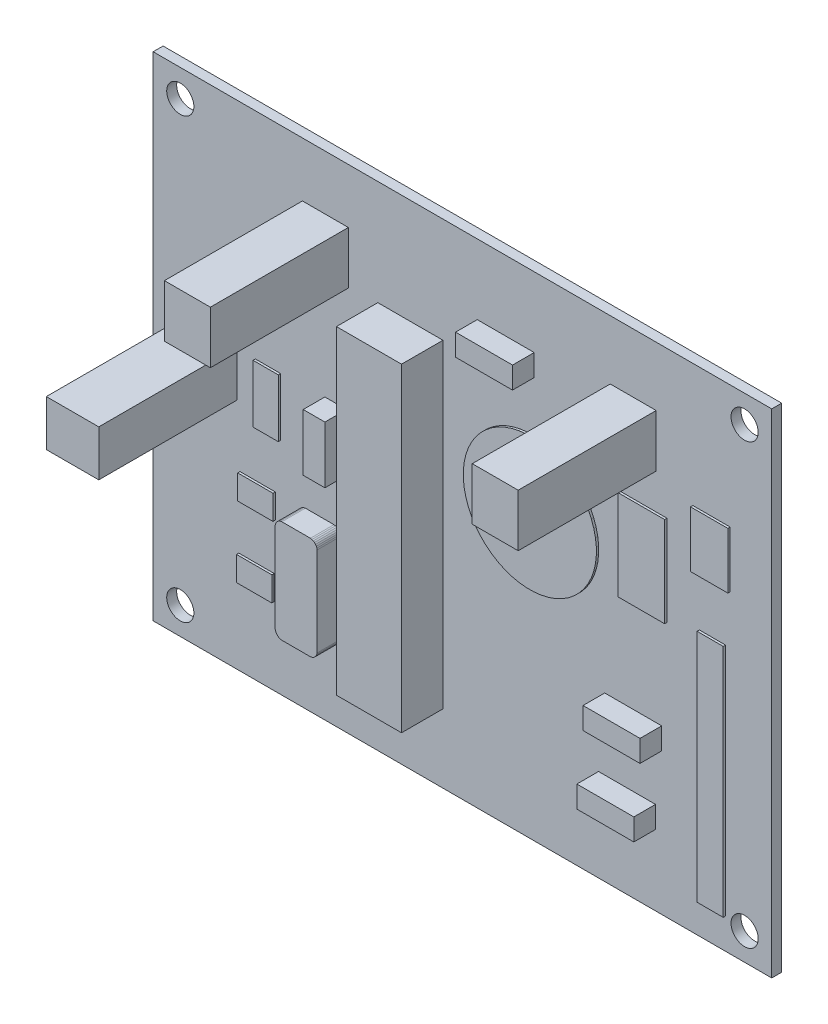
from build123d import *

# Parameters (mm, degrees)
SKETCH1_W                     = 68.4
SKETCH1_H                     = 54.5
BOARD_DEPTH                   = 1.1
SKETCH2_W                     = 2.89
SKETCH2_H                     = 25.95
FP_61301011121_MFG_1_DEPTH    = 0.254
SKETCH3_W                     = 5.16
SKETCH3_H                     = 9.98
FP_3296W_MFG_1_DEPTH          = 0.254
SKETCH4_W                     = 6.3
SKETCH4_H                     = 2.4
RESA60_630X240_1_DEPTH        = 2.3984
SKETCH5_W                     = 6.3
SKETCH5_H                     = 2.4
RESA60_630X240_2_DEPTH        = 2.3984
SKETCH6_W                     = 2.4
SKETCH6_H                     = 6.3
RESA60_630X240_3_DEPTH        = 2.3984
SKETCH7_W                     = 6.3
SKETCH7_H                     = 2.4
RESA60_630X240_4_DEPTH        = 2.3984
SKETCH8_W                     = 5.08
SKETCH8_H                     = 5.7999
MOLX_22_27_2021_V_1_DEPTH     = 15.26
SKETCH9_W                     = 5.08
SKETCH9_H                     = 5.7999
MOLX_22_27_2021_V_2_DEPTH     = 15.26
SKETCH10_W                    = 5.7999
SKETCH10_H                    = 5.08
MOLX_22_27_2021_V_3_DEPTH     = 15.26
SKETCH14_W                    = 4.14
SKETCH14_H                    = 6.2
FP_TMM_103_03_T_S_MFG_1_DEPTH = 0.254
FOX_FOXSLF160_20_1_DEPTH      = 2.6
SKETCH16_W                    = 7.2
SKETCH16_H                    = 35.3
EXTRUDE_28P3_1_DEPTH          = 4.58
SKETCH17_W                    = 2.8
SKETCH17_H                    = 6.4
FP_K15H5_MFG_1_DEPTH          = 0.254
SKETCH18_W                    = 3.9
SKETCH18_H                    = 2.7
FP_RCE0DB_MFG_1_DEPTH         = 0.254
SKETCH19_W                    = 3.9
SKETCH19_H                    = 2.7
FP_RCE0DB_MFG_2_DEPTH         = 0.254
FP_PS1440P02BT_MFG_1_DEPTH    = 0.254
SKETCH21_R                    = 1.5
CUT_EXTRUDE1_DEPTH            = 1.1


with BuildPart() as part:
    # Sketch1 → BOARD (new body)
    with BuildSketch(Plane.XY):
        with Locations((34.2, 27.35)):
            Rectangle(SKETCH1_W, SKETCH1_H)
    extrude(amount=BOARD_DEPTH)

    # Sketch21 → Cut-Extrude1 (cut)
    with BuildSketch(Plane.XY.offset(1.1)):
        with Locations((65.4, 51.6)):
            Circle(SKETCH21_R)
        with Locations((3, 51.6)):
            Circle(SKETCH21_R)
        with Locations((3, 3.1)):
            Circle(SKETCH21_R)
        with Locations((65.4, 3.1)):
            Circle(SKETCH21_R)
    extrude(amount=-CUT_EXTRUDE1_DEPTH, mode=Mode.SUBTRACT)


with BuildPart() as body_2:
    # Sketch2 → FP-61301011121-MFG-1 (new body)
    with BuildSketch(Plane.XY.offset(1.1)):
        with Locations((61.845, 16.454)):
            Rectangle(SKETCH2_W, SKETCH2_H)
    extrude(amount=FP_61301011121_MFG_1_DEPTH)


with BuildPart() as body_3:
    # Sketch3 → FP-3296W-MFG-1 (new body)
    with BuildSketch(Plane.XY.offset(1.1)):
        with Locations((54.225, 33.345)):
            Rectangle(SKETCH3_W, SKETCH3_H)
    extrude(amount=FP_3296W_MFG_1_DEPTH)


with BuildPart() as body_4:
    # Sketch4 → RESA60-630X240-1 (new body)
    with BuildSketch(Plane.XY.offset(1.1)):
        with Locations((52.4, 9.1)):
            Rectangle(SKETCH4_W, SKETCH4_H)
    extrude(amount=RESA60_630X240_1_DEPTH)


with BuildPart() as body_5:
    # Sketch5 → RESA60-630X240-2 (new body)
    with BuildSketch(Plane.XY.offset(1.1)):
        with Locations((53.082, 16.962)):
            Rectangle(SKETCH5_W, SKETCH5_H)
    extrude(amount=RESA60_630X240_2_DEPTH)


with BuildPart() as body_6:
    # Sketch6 → RESA60-630X240-3 (new body)
    with BuildSketch(Plane.XY.offset(1.1)):
        with Locations((20.189, 27.884)):
            Rectangle(SKETCH6_W, SKETCH6_H)
    extrude(amount=RESA60_630X240_3_DEPTH)


with BuildPart() as body_7:
    # Sketch7 → RESA60-630X240-4 (new body)
    with BuildSketch(Plane.XY.offset(1.1)):
        with Locations((38.985, 45.664)):
            Rectangle(SKETCH7_W, SKETCH7_H)
    extrude(amount=RESA60_630X240_4_DEPTH)


with BuildPart() as body_8:
    # Sketch8 → MOLX-22-27-2021_V-1 (new body)
    with BuildSketch(Plane.XY.offset(1.1)):
        with Locations((53.0822, 45.15615)):
            Rectangle(SKETCH8_W, SKETCH8_H)
    extrude(amount=MOLX_22_27_2021_V_1_DEPTH)


with BuildPart() as body_9:
    # Sketch9 → MOLX-22-27-2021_V-2 (new body)
    with BuildSketch(Plane.XY.offset(1.1)):
        with Locations((19.0458, 45.66385)):
            Rectangle(SKETCH9_W, SKETCH9_H)
    extrude(amount=MOLX_22_27_2021_V_2_DEPTH)


with BuildPart() as body_10:
    # Sketch10 → MOLX-22-27-2021_V-3 (new body)
    with BuildSketch(Plane.XY.offset(1.1)):
        with Locations((6.34585, 28.3922)):
            Rectangle(SKETCH10_W, SKETCH10_H)
    extrude(amount=MOLX_22_27_2021_V_3_DEPTH)


with BuildPart() as body_11:
    # Sketch14 → FP-TMM-103-03-T-S-MFG-1 (new body)
    with BuildSketch(Plane.XY.offset(1.1)):
        with Locations((61.738, 37.885)):
            Rectangle(SKETCH14_W, SKETCH14_H)
    extrude(amount=FP_TMM_103_03_T_S_MFG_1_DEPTH)


with BuildPart() as body_12:
    # Sketch15 → FOX-FOXSLF160-20-1 (new body)
    with BuildSketch(Plane.XY.offset(1.1)):
        Polygon((20.1515, 19.2764), (20.3017, 19.2142), (20.4368, 19.1239), (20.5517, 19.009), (20.642, 18.8739), (20.7042, 18.7237), (20.7359, 18.5643), (20.7359, 18.4831), (20.7359, 8.7831), (20.7359, 8.7018), (20.7042, 8.5425), (20.642, 8.3923), (20.5517, 8.2572), (20.4368, 8.1423), (20.3017, 8.052), (20.1516, 7.9898), (19.9922, 7.9581), (19.9109, 7.9581), (16.9109, 7.9581), (16.8296, 7.9581), (16.6703, 7.9898), (16.5201, 8.052), (16.385, 8.1423), (16.2701, 8.2572), (16.1798, 8.3923), (16.1176, 8.5424), (16.0859, 8.7018), (16.0859, 8.783), (16.0859, 18.4831), (16.0859, 18.5643), (16.1176, 18.7237), (16.1798, 18.8739), (16.2701, 19.009), (16.385, 19.1239), (16.5201, 19.2142), (16.6703, 19.2764), (16.8296, 19.3081), (16.9109, 19.3081), (19.9109, 19.3081), (19.9921, 19.3081), align=None)
    extrude(amount=FOX_FOXSLF160_20_1_DEPTH)


with BuildPart() as body_13:
    # Sketch16 → Extrude 28P3-1 (new body)
    with BuildSketch(Plane.XY.offset(1.1)):
        with Locations((28.444, 25.344)):
            Rectangle(SKETCH16_W, SKETCH16_H)
    extrude(amount=EXTRUDE_28P3_1_DEPTH)


with BuildPart() as body_14:
    # Sketch17 → FP-K15H5-MFG-1 (new body)
    with BuildSketch(Plane.XY.offset(1.1)):
        with Locations((12.696, 27.63)):
            Rectangle(SKETCH17_W, SKETCH17_H)
    extrude(amount=FP_K15H5_MFG_1_DEPTH)


with BuildPart() as body_15:
    # Sketch18 → FP-RCE0DB-MFG-1 (new body)
    with BuildSketch(Plane.XY.offset(1.1)):
        with Locations((11.426, 9.977)):
            Rectangle(SKETCH18_W, SKETCH18_H)
    extrude(amount=FP_RCE0DB_MFG_1_DEPTH)


with BuildPart() as body_16:
    # Sketch19 → FP-RCE0DB-MFG-2 (new body)
    with BuildSketch(Plane.XY.offset(1.1)):
        with Locations((11.553, 17.851)):
            Rectangle(SKETCH19_W, SKETCH19_H)
    extrude(amount=FP_RCE0DB_MFG_2_DEPTH)


with BuildPart() as body_17:
    # Sketch20 → FP-PS1440P02BT-MFG-1 (new body)
    with BuildSketch(Plane.XY.offset(1.1)):
        Polygon((43.1391, 38.7846), (43.9439, 38.6009), (44.7232, 38.3282), (45.4669, 37.97), (46.1659, 37.5308), (46.8113, 37.0161), (47.3951, 36.4324), (47.9098, 35.7869), (48.349, 35.0879), (48.7072, 34.3442), (48.9799, 33.5649), (49.1636, 32.7601), (49.256, 31.9398), (49.256, 31.1142), (49.1636, 30.2939), (48.9799, 29.4891), (48.7072, 28.7099), (48.349, 27.9661), (47.9098, 27.2671), (47.3951, 26.6217), (46.8113, 26.0379), (46.1659, 25.5232), (45.4669, 25.084), (44.7232, 24.7258), (43.9439, 24.4531), (43.1391, 24.2694), (42.3188, 24.177), (41.4932, 24.177), (40.6729, 24.2694), (39.8681, 24.4531), (39.0888, 24.7258), (38.3451, 25.084), (37.6461, 25.5232), (37.0006, 26.0379), (36.4169, 26.6217), (35.9022, 27.2671), (35.463, 27.9661), (35.1048, 28.7099), (34.8321, 29.4891), (34.6484, 30.2939), (34.556, 31.1143), (34.556, 31.9398), (34.6484, 32.7601), (34.8321, 33.5649), (35.1048, 34.3442), (35.463, 35.0879), (35.9022, 35.7869), (36.4169, 36.4324), (37.0006, 37.0161), (37.6461, 37.5308), (38.3451, 37.97), (39.0888, 38.3282), (39.8681, 38.6009), (40.6729, 38.7846), (41.4932, 38.877), (42.3188, 38.877), align=None)
    extrude(amount=FP_PS1440P02BT_MFG_1_DEPTH)


solid = Compound([part.part, body_2.part, body_3.part, body_4.part, body_5.part, body_6.part, body_7.part, body_8.part, body_9.part, body_10.part, body_11.part, body_12.part, body_13.part, body_14.part, body_15.part, body_16.part, body_17.part])
